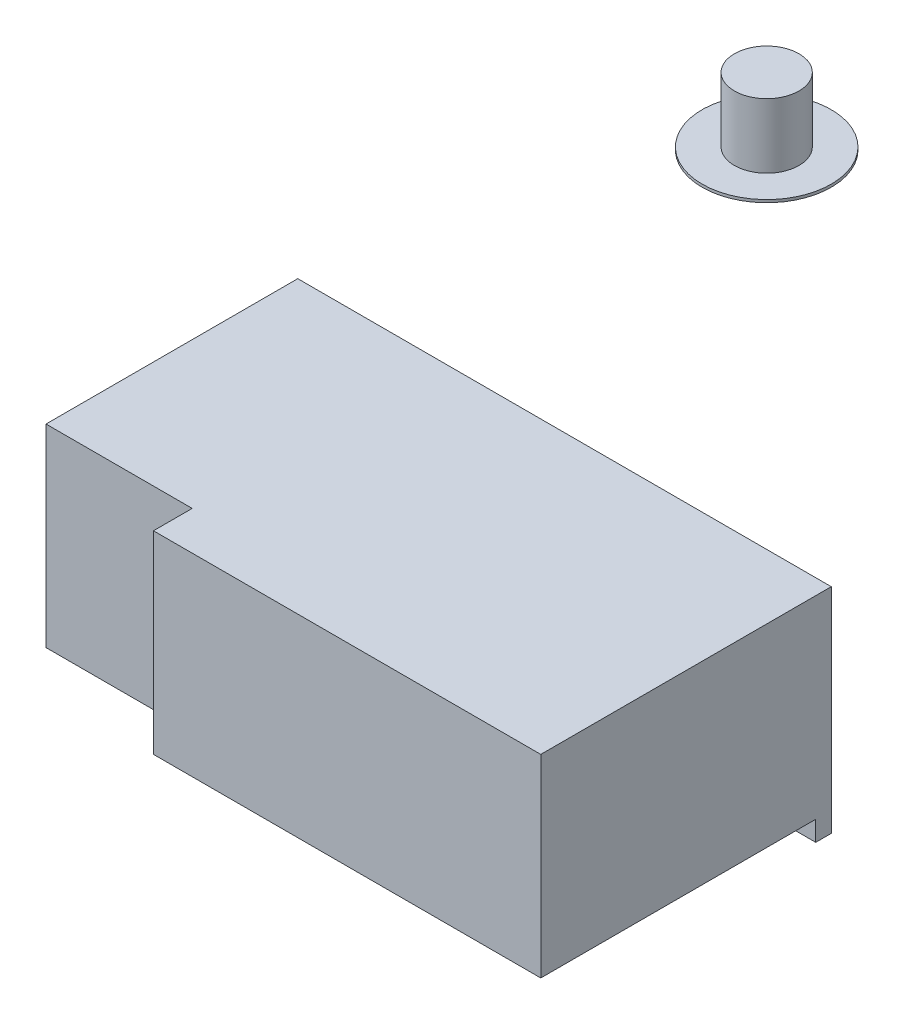
from build123d import *

# Parameters (mm, degrees)
CROQUIS1_W              = 30
CROQUIS1_H              = 45
SALIENTE_EXTRUIR1_DEPTH = 7.5
CROQUIS2_W              = 20
CROQUIS2_H              = 15
SALIENTE_EXTRUIR2_DEPTH = 15
CROQUIS3_W              = 20
CROQUIS3_H              = 15
SALIENTE_EXTRUIR3_DEPTH = 8
CROQUIS4_R              = 5
SALIENTE_EXTRUIR4_DEPTH = 2
CROQUIS5_R              = 2.5
SALIENTE_EXTRUIR5_DEPTH = 5
CROQUIS6_W              = 19.5
CROQUIS6_H              = 15
SALIENTE_EXTRUIR6_DEPTH = 16
CROQUIS7_W              = 46
CROQUIS7_H              = 1.203222492
SALIENTE_EXTRUIR7_DEPTH = 1.55
CROQUIS9_W              = 23.595920382
CROQUIS9_H              = 45.94478853
CORTAR_EXTRUIR1_DEPTH   = 41.55
CROQUIS10_W             = 4.677949999
CROQUIS10_H             = 19.5
CORTAR_EXTRUIR2_DEPTH   = 20


with BuildPart() as part:
    # Croquis1 → Saliente-Extruir1 (new, symmetric)
    with BuildSketch(Plane(origin=(0, 0, 0), x_dir=(1, 0, 0), z_dir=(0, 1, 0))):
        Rectangle(CROQUIS1_W, CROQUIS1_H)
    extrude(amount=SALIENTE_EXTRUIR1_DEPTH, both=True)

    # Croquis2 → Saliente-Extruir2 (add)
    with BuildSketch(Plane(origin=(0, 7.5, 0), x_dir=(1, 0, 0), z_dir=(0, 1, 0))):
        with Locations((0, 10)):
            Rectangle(CROQUIS2_W, CROQUIS2_H)
    extrude(amount=SALIENTE_EXTRUIR2_DEPTH)

    # Croquis3 → Saliente-Extruir3 (add)
    with BuildSketch(Plane.XZ.offset(7.5)):
        with Locations((0, -10)):
            Rectangle(CROQUIS3_W, CROQUIS3_H)
    extrude(amount=SALIENTE_EXTRUIR3_DEPTH)

    # Croquis4 → Saliente-Extruir4 (add)
    with BuildSketch(Plane(origin=(0, 22.5, 0), x_dir=(1, 0, 0), z_dir=(0, 1, 0))):
        with Locations(Location((0, 10, 0), (0, 0, 270))):
            Circle(CROQUIS4_R)
    extrude(amount=SALIENTE_EXTRUIR4_DEPTH)

    # Croquis5 → Saliente-Extruir5 (add)
    with BuildSketch(Plane(origin=(0, 24.5, 0), x_dir=(1, 0, 0), z_dir=(0, 1, 0))):
        with Locations(Location((0, 10, 0), (0, 0, 270))):
            Circle(CROQUIS5_R)
    extrude(amount=SALIENTE_EXTRUIR5_DEPTH)

    # Croquis6 → Saliente-Extruir6 (add)
    with BuildSketch(Plane.ZY.offset(15)):
        with Locations((9.75, 0)):
            Rectangle(CROQUIS6_W, CROQUIS6_H)
    extrude(amount=SALIENTE_EXTRUIR6_DEPTH)

    # Croquis7 → Saliente-Extruir7 (add)
    with BuildSketch(Plane.XZ.offset(7.5)):
        with Locations((-8, 0.601611246)):
            Rectangle(CROQUIS7_W, CROQUIS7_H)
    extrude(amount=SALIENTE_EXTRUIR7_DEPTH)

    # Croquis9 → Cortar-Extruir1 (cut)
    with BuildSketch(Plane.ZY.offset(15)):
        with Locations((-11.797960191, 1.315469515)):
            Rectangle(CROQUIS9_W, CROQUIS9_H)
    extrude(amount=-CORTAR_EXTRUIR1_DEPTH, mode=Mode.SUBTRACT)


with BuildPart() as cortar_extruir1_piece_1:
    # of the separate pieces the step leaves, piece 1, a body of its own (cortar_extruir1_pieces)
    add(part.part.solids().sort_by_distance((-31, 7.5, 0))[0])

    # Croquis10 → Cortar-Extruir2 (cut)
    with BuildSketch(Plane(origin=(0, 7.5, 0), x_dir=(1, 0, 0), z_dir=(0, 1, 0))):
        with Locations((-28.661025001, -9.75)):
            Rectangle(CROQUIS10_W, CROQUIS10_H)
    extrude(amount=-CORTAR_EXTRUIR2_DEPTH, mode=Mode.SUBTRACT)


with BuildPart() as cortar_extruir1_piece_2:
    # of the separate pieces the step leaves, piece 2, a body of its own (cortar_extruir1_pieces)
    add(part.part.solids().sort_by_distance((0, 24.28786378, -5))[0])


solid = Compound([cortar_extruir1_piece_1.part, cortar_extruir1_piece_2.part])
